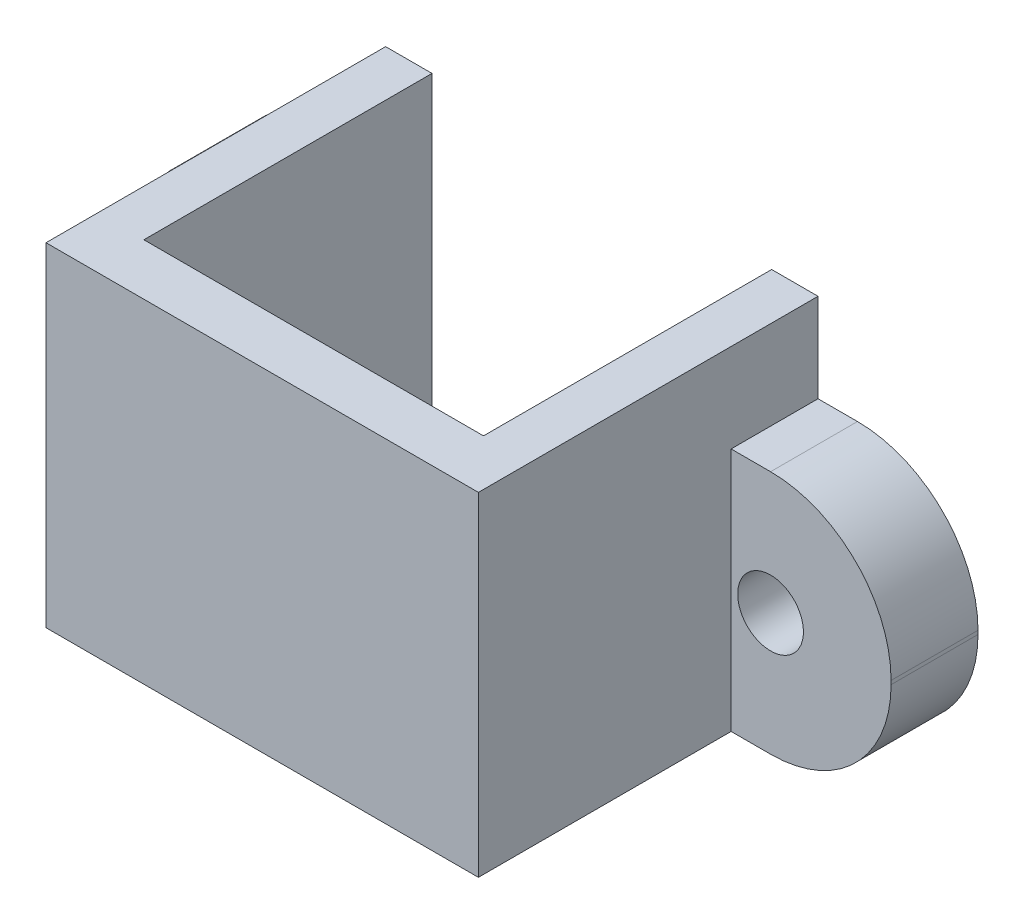
from build123d import *

# Parameters (mm, degrees)
BOSS_EXTRUDE1_DEPTH = 11.5951
CUT_EXTRUDE4_DEPTH  = 31.957976501
SKETCH4_R           = 1.143
CUT_EXTRUDE5_DEPTH  = 30.935473315


with BuildPart() as part:
    # Sketch1 → Boss-Extrude1 (new body)
    with BuildSketch(Plane(origin=(0, 0, 0), x_dir=(1, 0, 0), z_dir=(0, 1, 0))):
        Polygon((0, 0), (7.1755, 0), (7.1755, -10.0203), (18.9865, -10.0203), (18.9865, 0), (26.162, 0), (26.162, -3.0226), (20.5994, -3.0226), (20.5994, -11.811), (5.5626, -11.811), (5.5626, -3.0226), (0, -3.0226), align=None)
    extrude(amount=BOSS_EXTRUDE1_DEPTH)

    # Sketch2 → Cut-Extrude4 (cut, through all)
    with BuildSketch(Plane.XY.offset(11.811)):
        with BuildLine():
            Line((5.5626, 8.509), (5.5626, 11.5951))
            Line((5.5626, 11.5951), (0, 11.5951))
            Line((0, 11.5951), (0, 4.318))
            ThreePointArc((0, 4.318), (1.22751548, 7.28148452), (4.191, 8.509))
            Line((4.191, 8.509), (5.5626, 8.509))
        make_face()
        with BuildLine():
            ThreePointArc((4.191, 0), (1.22751548, 1.22751548), (0, 4.191))
            Line((0, 4.191), (0, 0))
            Line((0, 0), (4.191, 0))
        make_face()
        with BuildLine():
            Line((26.162, 11.5951), (20.5994, 11.5951))
            Line((20.5994, 11.5951), (20.5994, 8.509))
            Line((20.5994, 8.509), (21.971, 8.509))
            ThreePointArc((21.971, 8.509), (24.93448452, 7.28148452), (26.162, 4.318))
            Line((26.162, 4.318), (26.162, 11.5951))
        make_face()
        with BuildLine():
            Line((26.162, 0), (26.162, 4.191))
            ThreePointArc((26.162, 4.191), (24.93448452, 1.22751548), (21.971, 0))
            Line((21.971, 0), (26.162, 0))
        make_face()
    extrude(amount=-CUT_EXTRUDE4_DEPTH, mode=Mode.SUBTRACT)

    # Sketch4 → Cut-Extrude5 (cut, through all)
    with BuildSketch(Plane.XY.offset(3.0226)):
        with Locations((4.191, 4.2545)):
            Circle(SKETCH4_R)
        with Locations((21.971, 4.2545)):
            Circle(SKETCH4_R)
    extrude(amount=-CUT_EXTRUDE5_DEPTH, mode=Mode.SUBTRACT)


solid = part.part
